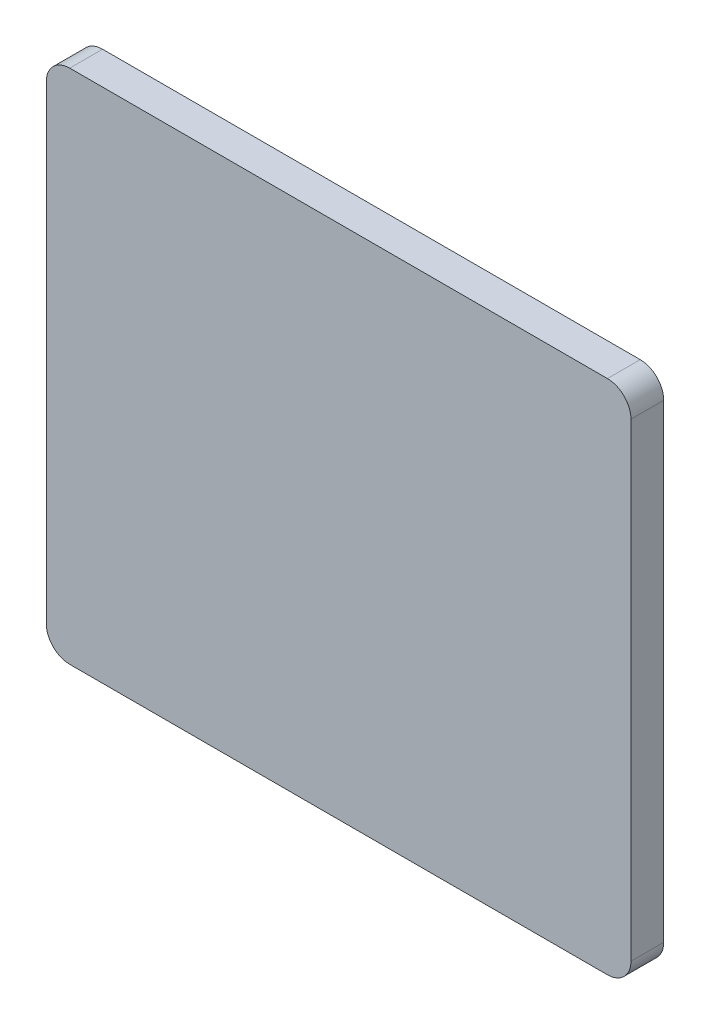
from build123d import *

# Parameters (mm, degrees)
BOSS_EXTRUDE3_DEPTH = 5
BOSS_EXTRUDE5_DEPTH = 6


with BuildPart() as part:
    # Sketch3 → Boss-Extrude3 (new body)
    with BuildSketch(Plane.XY):
        with BuildLine():
            Line((-97.5, 69.7), (-97.5, -16.2))
            ThreePointArc((-97.5, -16.2), (-96.826345597, -17.826345597), (-95.2, -18.5))
            Line((-95.2, -18.5), (3.2, -18.5))
            ThreePointArc((3.2, -18.5), (4.826345597, -17.826345597), (5.5, -16.2))
            Line((5.5, -16.2), (5.5, 69.7))
            ThreePointArc((5.5, 69.7), (4.826345597, 71.326345597), (3.2, 72))
            Line((3.2, 72), (-95.2, 72))
            ThreePointArc((-95.2, 72), (-96.826345597, 71.326345597), (-97.5, 69.7))
        make_face()
    extrude(amount=BOSS_EXTRUDE3_DEPTH)

    # Sketch4 → Boss-Extrude5 (add)
    with BuildSketch(Plane.XY.offset(5)):
        with BuildLine():
            Line((-99.5, 69.7), (-99.5, -16.2))
            ThreePointArc((-99.5, -16.2), (-98.240559159, -19.240559159), (-95.2, -20.5))
            Line((-95.2, -20.5), (3.2, -20.5))
            ThreePointArc((3.2, -20.5), (6.240559159, -19.240559159), (7.5, -16.2))
            Line((7.5, -16.2), (7.5, 69.7))
            ThreePointArc((7.5, 69.7), (6.240559159, 72.740559159), (3.2, 74))
            Line((3.2, 74), (-95.2, 74))
            ThreePointArc((-95.2, 74), (-98.240559159, 72.740559159), (-99.5, 69.7))
        make_face()
    extrude(amount=-BOSS_EXTRUDE5_DEPTH)


solid = part.part
